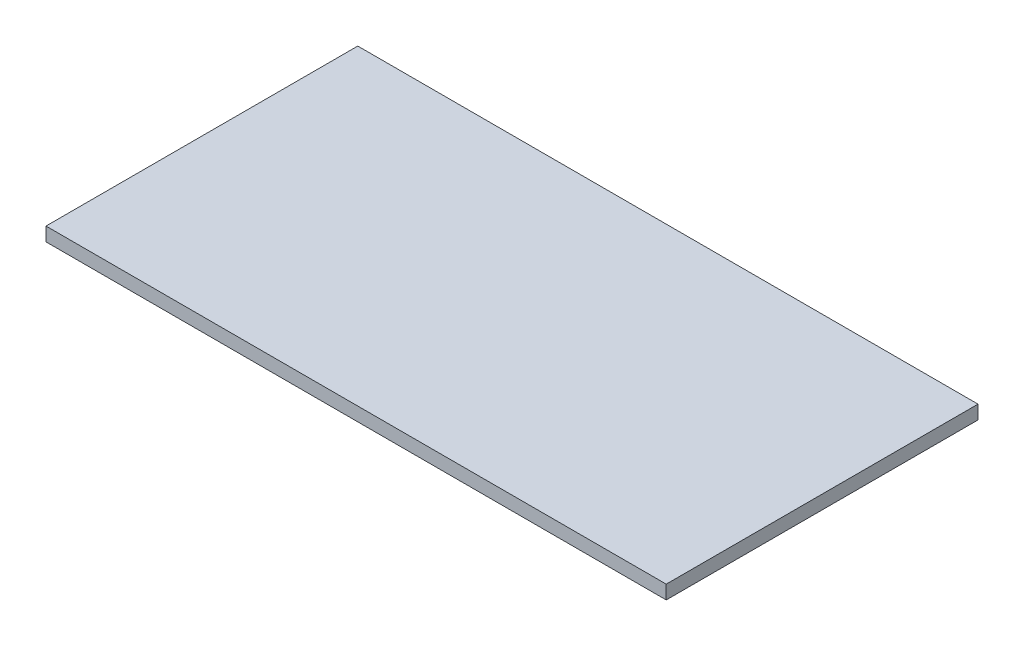
from build123d import *

# Parameters (mm, degrees)
SKETCH1_W           = 1492
SKETCH1_H           = 750
BOSS_EXTRUDE1_DEPTH = 33


with BuildPart() as part:
    # Sketch1 → Boss-Extrude1 (new body)
    with BuildSketch(Plane(origin=(0, 0, 0), x_dir=(1, 0, 0), z_dir=(0, 1, 0))):
        with Locations((746, 375)):
            Rectangle(SKETCH1_W, SKETCH1_H)
    extrude(amount=BOSS_EXTRUDE1_DEPTH)


solid = part.part
